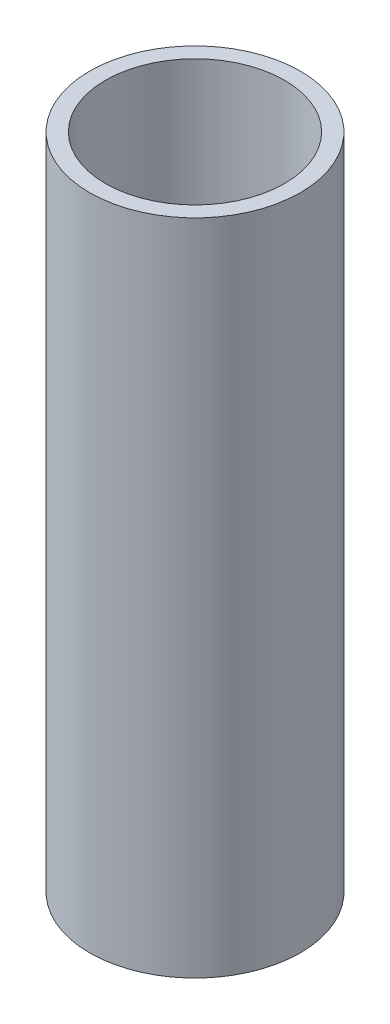
from build123d import *

# Parameters (mm, degrees)
SKETCH_1_R      = 16
SKETCH_1_R_2    = 13.6
EXTRUDE_1_DEPTH = 100


with BuildPart() as part:
    # 草图1 → 凸台-拉伸1 (new body)
    with BuildSketch(Plane(origin=(0, 0, 0), x_dir=(1, 0, 0), z_dir=(0, 1, 0))):
        with Locations(Location((0, 0, 0), (0, 0, 270))):
            Circle(SKETCH_1_R)
        with Locations(Location((0, 0, 0), (0, 0, 270))):
            Circle(SKETCH_1_R_2, mode=Mode.SUBTRACT)
    extrude(amount=EXTRUDE_1_DEPTH)


solid = part.part
